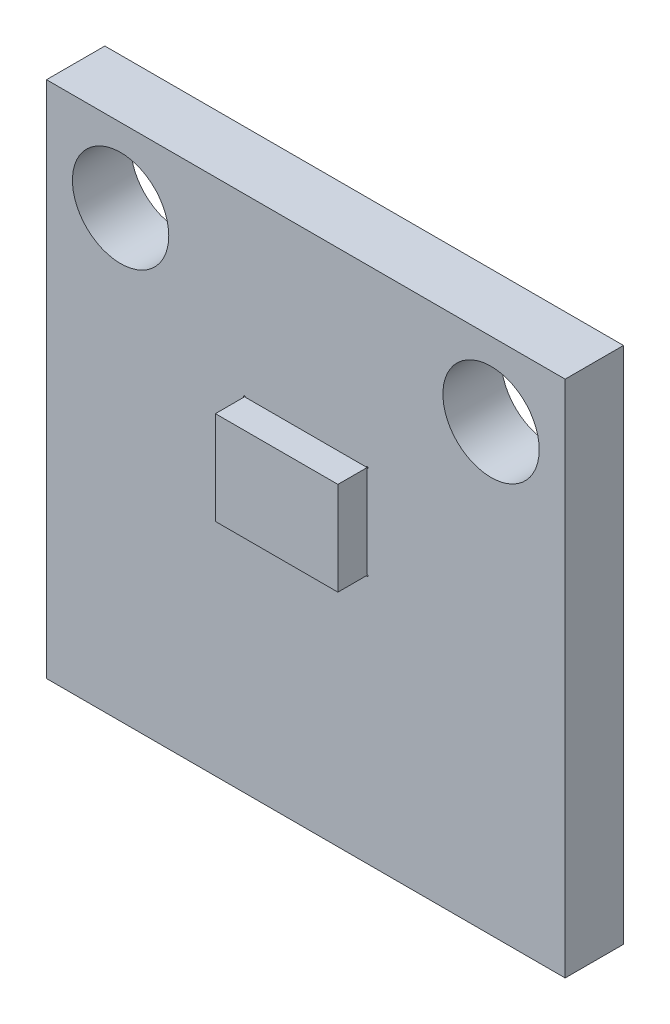
from build123d import *

# Parameters (mm, degrees)
MODEL_W             = 17.78
MODEL_H             = 17.78
MODEL_R             = 1.651
BOSS_EXTRUDE1_DEPTH = 2
BOSS_EXTRUDE2_DEPTH = 3


with BuildPart() as part:
    # Model → Boss-Extrude1 (new body)
    with BuildSketch(Plane.XY):
        with Locations((8.89, 8.89)):
            Rectangle(MODEL_W, MODEL_H)
        with Locations((2.54, 15.24)):
            Circle(MODEL_R, mode=Mode.SUBTRACT)
        with BuildLine():
            Line((10.9582458, 8.5600032), (10.9899958, 8.5600032))
            Line((10.9899958, 8.5600032), (10.9899958, 8.5917532))
            ThreePointArc((10.9899958, 8.5917532), (11.01244644, 8.53755256), (10.9582458, 8.5600032))
        make_face(mode=Mode.SUBTRACT)
        with BuildLine():
            Line((10.9899958, 11.7282468), (10.9899958, 11.7599968))
            Line((10.9899958, 11.7599968), (10.9582458, 11.7599968))
            ThreePointArc((10.9582458, 11.7599968), (11.01244644, 11.78244744), (10.9899958, 11.7282468))
        make_face(mode=Mode.SUBTRACT)
        with BuildLine():
            Line((6.8217542, 11.7599968), (6.7900042, 11.7599968))
            Line((6.7900042, 11.7599968), (6.7900042, 11.7282468))
            ThreePointArc((6.7900042, 11.7282468), (6.76755356, 11.78244744), (6.8217542, 11.7599968))
        make_face(mode=Mode.SUBTRACT)
        with BuildLine():
            Line((6.7900042, 8.5917532), (6.7900042, 8.5600032))
            Line((6.7900042, 8.5600032), (6.8217542, 8.5600032))
            ThreePointArc((6.8217542, 8.5600032), (6.76755356, 8.53755256), (6.7900042, 8.5917532))
        make_face(mode=Mode.SUBTRACT)
        with Locations((15.24, 15.24)):
            Circle(MODEL_R, mode=Mode.SUBTRACT)
    extrude(amount=BOSS_EXTRUDE1_DEPTH)

    # Model<3> → Boss-Extrude2 (add)
    with BuildSketch(Plane.XY):
        Polygon((6.7900042, 8.5917532), (6.7900042, 8.5600032), (6.8217542, 8.5600032), (10.9582458, 8.5600032), (10.9899958, 8.5600032), (10.9899958, 8.5917532), (10.9899958, 11.7282468), (10.9899958, 11.7599968), (10.9582458, 11.7599968), (6.8217542, 11.7599968), (6.7900042, 11.7599968), (6.7900042, 11.7282468), align=None)
    extrude(amount=BOSS_EXTRUDE2_DEPTH)


solid = part.part
